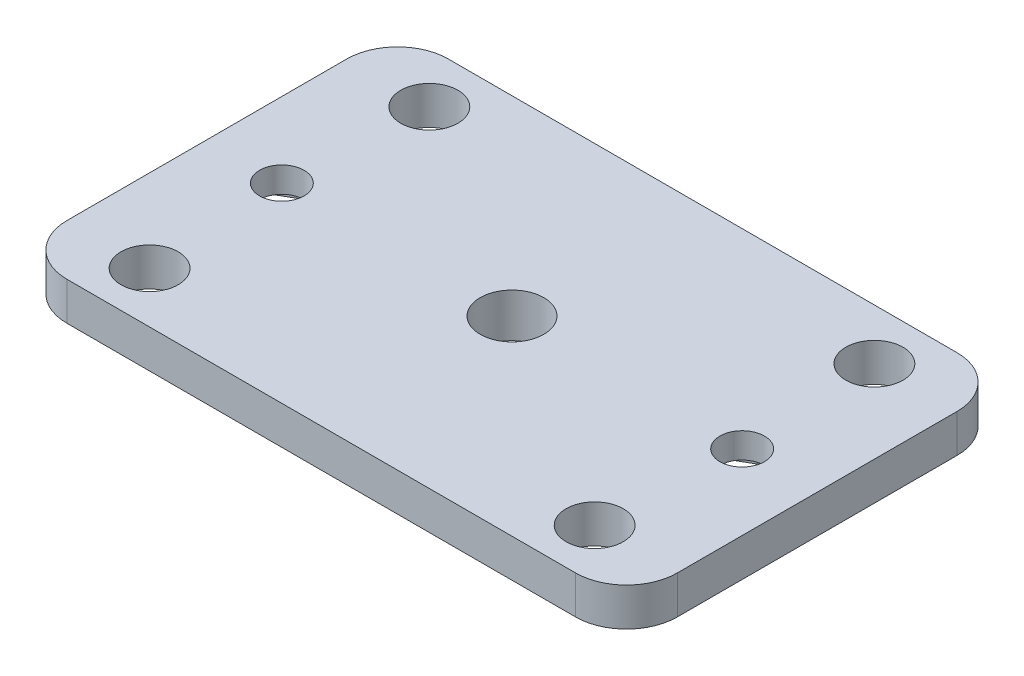
from build123d import *
from build123d.topology import SkipClean

# Parameters (mm, degrees)
ESBO_O1_R                = 2.502267334
ESBO_O1_R_2              = 2.25
ESBO_O1_R_3              = 1.75
RESSALTO_EXTRUS_O1_DEPTH = 3
CORTE_EXTRUS_O1_DEPTH    = 1
ESBO_O1_4_R              = 13.75
CORTE_EXTRUS_O3_DEPTH    = 0.55
RESSALTO_EXTRUS_O2_START = 1
ESBO_O2_R                = 3.502267334
ESBO_O2_R_2              = 2.502267334
RESSALTO_EXTRUS_O2_DEPTH = 1
ESBO_O1_5_R              = 12.085266094
ESBO_O1_5_R_2            = 3.5
CORTE_EXTRUS_O4_DEPTH    = 1.45


with BuildPart() as part:
    # Esboço1 → Ressalto-extrusão1 (new body)
    with BuildSketch(Plane(origin=(0, 0, 0), x_dir=(1, 0, 0), z_dir=(0, 1, 0))):
        with BuildLine():
            Line((-20, -15), (20, -15))
            ThreePointArc((20, -15), (22.828427125, -13.828427125), (24, -11))
            Line((24, -11), (24, 11))
            ThreePointArc((24, 11), (22.828427125, 13.828427125), (20, 15))
            Line((20, 15), (-20, 15))
            ThreePointArc((-20, 15), (-22.828427125, 13.828427125), (-24, 11))
            Line((-24, 11), (-24, -11))
            ThreePointArc((-24, -11), (-22.828427125, -13.828427125), (-20, -15))
        make_face()
        with Locations(Location((0, 0, 0), (0, 0, 270))):
            Circle(ESBO_O1_R, mode=Mode.SUBTRACT)
        with Locations(Location((-17.5, -11, 0), (0, 0, 270))):
            Circle(ESBO_O1_R_2, mode=Mode.SUBTRACT)
        with Locations(Location((-17.5, 11, 0), (0, 0, 270))):
            Circle(ESBO_O1_R_2, mode=Mode.SUBTRACT)
        with Locations(Location((17.5, -11, 0), (0, 0, 270))):
            Circle(ESBO_O1_R_2, mode=Mode.SUBTRACT)
        with Locations(Location((17.5, 11, 0), (0, 0, 270))):
            Circle(ESBO_O1_R_2, mode=Mode.SUBTRACT)
        with Locations(Location((-18.1, 0, 0), (0, 0, 270))):
            Circle(ESBO_O1_R_3, mode=Mode.SUBTRACT)
        with Locations(Location((18.1, 0, 0), (0, 0, 270))):
            Circle(ESBO_O1_R_3, mode=Mode.SUBTRACT)
    extrude(amount=RESSALTO_EXTRUS_O1_DEPTH)

    # Esboço1<3> → Corte-extrusão1 (cut)
    with BuildSketch(Plane(origin=(0, 0, 0), x_dir=(1, 0, 0), z_dir=(0, 1, 0))):
        Polygon((-21, 1.674315781), (-21, -1.674315781), (-18.1, -3.348631561), (-15.2, -1.674315781), (-15.2, 1.674315781), (-18.1, 3.348631561), align=None)
        Polygon((18.1, -3.348631561), (15.2, -1.674315781), (15.2, 1.674315781), (18.1, 3.348631561), (21, 1.674315781), (21, -1.674315781), align=None)
    extrude(amount=CORTE_EXTRUS_O1_DEPTH, mode=Mode.SUBTRACT)

    # Esboço1<4> → Corte-extrusão3 (cut)
    with BuildSketch(Plane(origin=(0, 0, 0), x_dir=(1, 0, 0), z_dir=(0, 1, 0))):
        with Locations(Location((0, 0, 0), (0, 0, 270))):
            Circle(ESBO_O1_4_R)
    extrude(amount=CORTE_EXTRUS_O3_DEPTH, mode=Mode.SUBTRACT)

    # Esboço2 → Ressalto-extrusão2 (add)
    with SkipClean():  # the faces are left unmerged after this step: merging them gives an invalid solid
        with BuildSketch(Plane.XZ.offset(-0.55).offset(RESSALTO_EXTRUS_O2_START)):
            with Locations(Location((0, 0, 0), (0, 0, 90))):
                Circle(ESBO_O2_R)
            with Locations(Location((0, 0, 0), (0, 0, 270))):
                Circle(ESBO_O2_R_2, mode=Mode.SUBTRACT)
        extrude(amount=-RESSALTO_EXTRUS_O2_DEPTH)

    # Esboço1<5> → Corte-extrusão4 (cut)
    with SkipClean():  # the faces are left unmerged after this step: merging them gives an invalid solid
        with BuildSketch(Plane(origin=(0, 0, 0), x_dir=(1, 0, 0), z_dir=(0, 1, 0))):
            with Locations(Location((0, 0, 0), (0, 0, 270))):
                Circle(ESBO_O1_5_R)
            with Locations(Location((0, 0, 0), (0, 0, 270))):
                Circle(ESBO_O1_5_R_2, mode=Mode.SUBTRACT)
        extrude(amount=CORTE_EXTRUS_O4_DEPTH, mode=Mode.SUBTRACT)


solid = part.part
